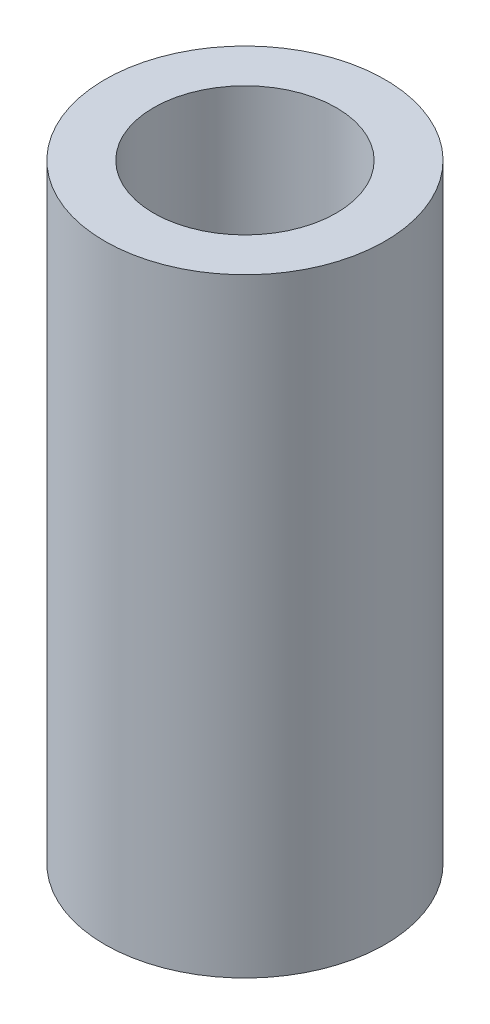
from build123d import *

# Parameters (mm, degrees)
SKETCH_1_R      = 2.3
SKETCH_1_R_2    = 1.5
EXTRUDE_1_DEPTH = 10


with BuildPart() as part:
    # 草图1 → 凸台-拉伸1 (new body)
    with BuildSketch(Plane(origin=(0, 0, 0), x_dir=(1, 0, 0), z_dir=(0, 1, 0))):
        with Locations(Location((0, 0, 0), (0, 0, 270))):
            Circle(SKETCH_1_R)
        with Locations(Location((0, 0, 0), (0, 0, 270))):
            Circle(SKETCH_1_R_2, mode=Mode.SUBTRACT)
    extrude(amount=EXTRUDE_1_DEPTH)


solid = part.part
